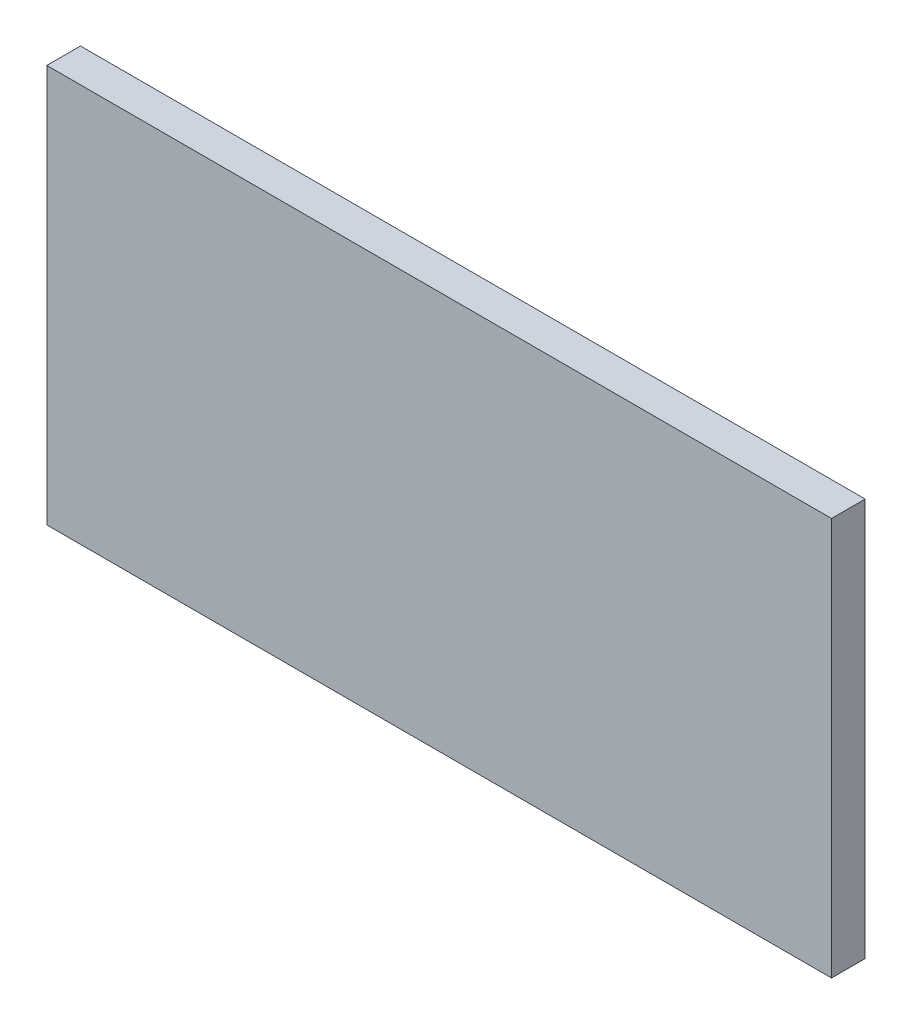
from build123d import *

# Parameters (mm, degrees)
SKETCH1_W           = 1400
SKETCH1_H           = 710
BOSS_EXTRUDE1_DEPTH = 60


with BuildPart() as part:
    # Sketch1 → Boss-Extrude1 (new body)
    with BuildSketch(Plane.XY):
        Rectangle(SKETCH1_W, SKETCH1_H)
    extrude(amount=BOSS_EXTRUDE1_DEPTH)


solid = part.part
